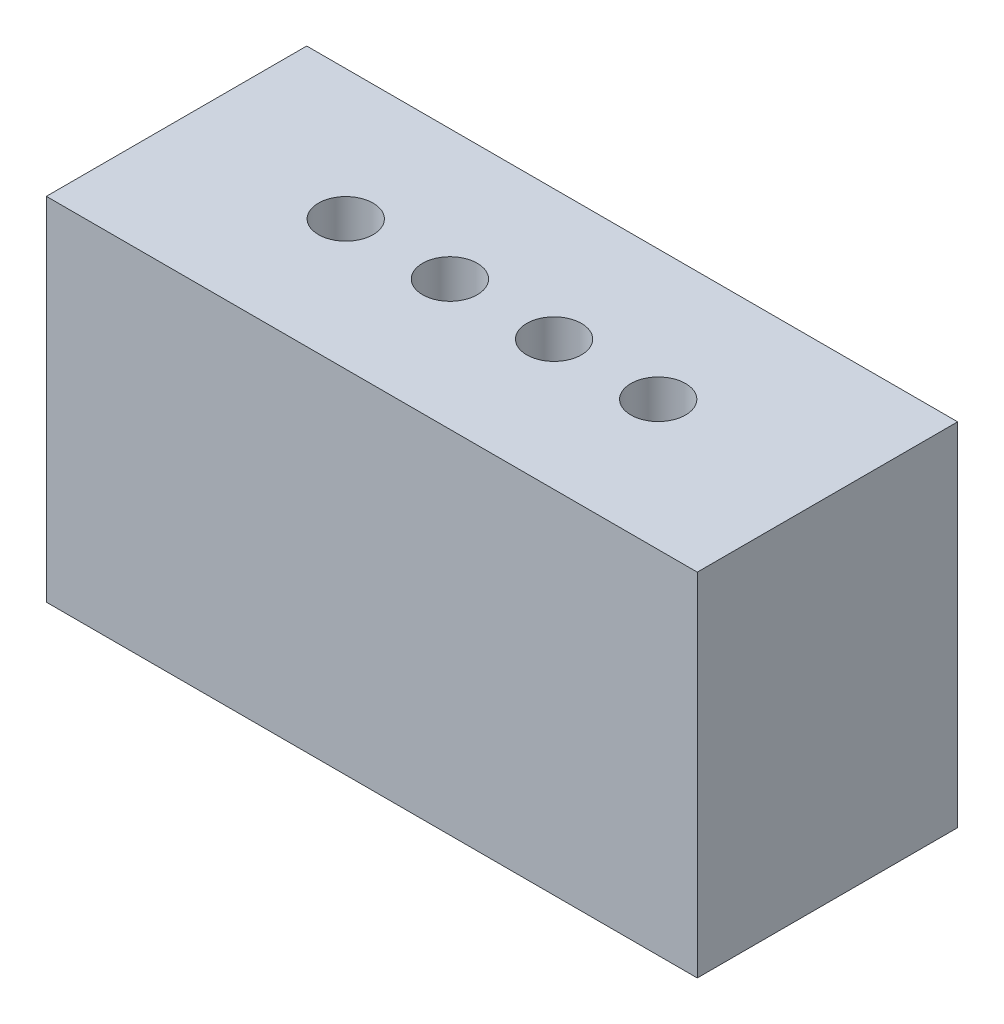
from build123d import *

# Parameters (mm, degrees)
SKIZZE1_W                        = 50
SKIZZE1_H                        = 20
AUFSATZ_LINEAR_AUSTRAGEN1_DEPTH  = 27
F_4_2_4_2_DURCHMESSER_BOHRUNG1_D = 4.2


with BuildPart() as part:
    # Skizze1 → Aufsatz-Linear austragen1 (new body)
    with BuildSketch(Plane(origin=(0, 0, 0), x_dir=(1, 0, 0), z_dir=(0, 1, 0))):
        with Locations((25, 10)):
            Rectangle(SKIZZE1_W, SKIZZE1_H)
    extrude(amount=AUFSATZ_LINEAR_AUSTRAGEN1_DEPTH)

    # Ø4.2 (4.2) Durchmesser Bohrung1 (through all)
    with Locations(Plane(origin=(0, 27, 0), x_dir=(1, 0, 0), z_dir=(0, 1, 0))):
        with Locations((37, 10), (13, 10), (21, 10), (29, 10)):
            Hole(F_4_2_4_2_DURCHMESSER_BOHRUNG1_D / 2)


solid = part.part
